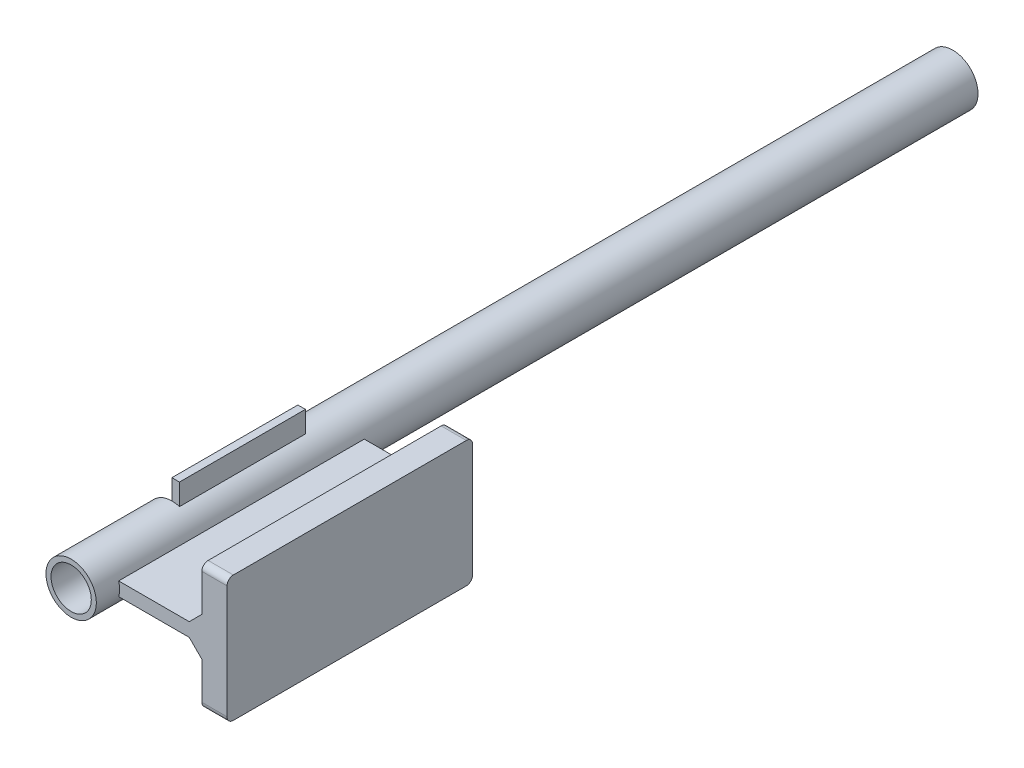
from build123d import *

# Parameters (mm, degrees)
SKETCH1_R           = 20
SKETCH1_R_2         = 16
BOSS_EXTRUDE1_DEPTH = 350
SKETCH2_W           = 46.702536181
SKETCH2_H           = 100
CUT_EXTRUDE1_DEPTH  = 100
SKETCH3_W           = 194.995303171
SKETCH3_H           = 10.817431772
BOSS_EXTRUDE2_DEPTH = 105.29
SKETCH4_W           = 194.995303171
SKETCH4_H           = 100
BOSS_EXTRUDE3_DEPTH = 20
CHAMFER1_SIZE       = 10
FILLET1_R           = 5
SKETCH5_W           = 100
SKETCH5_H           = 20
BOSS_EXTRUDE4_DEPTH = 6


with BuildPart() as part:
    # Sketch1 → Boss-Extrude1 (new, symmetric)
    with BuildSketch(Plane.XY):
        Circle(SKETCH1_R)
        Circle(SKETCH1_R_2, mode=Mode.SUBTRACT)
    extrude(amount=BOSS_EXTRUDE1_DEPTH, both=True)

    # Sketch2 → Cut-Extrude1 (cut, symmetric)
    with BuildSketch(Plane(origin=(0, 0, 0), x_dir=(1, 0, 0), z_dir=(0, 1, 0))):
        with Locations((-23.351268091, -220)):
            Rectangle(SKETCH2_W, SKETCH2_H)
    extrude(amount=CUT_EXTRUDE1_DEPTH, both=True, mode=Mode.SUBTRACT)

    # Sketch3 → Boss-Extrude2 (add)
    with BuildSketch(Plane(origin=(0, 0, 0), x_dir=(0, 0, -1), z_dir=(1, 0, 0))):
        with Locations((-234.028576152, 0)):
            Rectangle(SKETCH3_W, SKETCH3_H)
    extrude(amount=BOSS_EXTRUDE2_DEPTH)

    # Sketch4 → Boss-Extrude3 (add)
    with BuildSketch(Plane(origin=(105.29, 0, 0), x_dir=(0, 0, -1), z_dir=(1, 0, 0))):
        with Locations((-234.028576152, 0)):
            Rectangle(SKETCH4_W, SKETCH4_H)
    extrude(amount=-BOSS_EXTRUDE3_DEPTH)

    # Chamfer1
    chamfer1_edges = [part.edges().sort_by_distance(p)[0] for p in [
        (85.29, -5.408715886, 234.028576151),
        (85.29, 5.408715886, 234.028576151),
    ]]
    chamfer(chamfer1_edges, length=CHAMFER1_SIZE)

    # Fillet1
    fillet1_edges = [part.edges().sort_by_distance(p)[0] for p in [
        (95.29, 50, 136.530924566),
        (95.29, -50, 331.526227737),
        (95.29, -50, 136.530924566),
        (95.29, 50, 331.526227737),
    ]]
    fillet(fillet1_edges, radius=FILLET1_R)

    # Sketch5 → Boss-Extrude4 (add)
    with BuildSketch(Plane.ZY):
        with Locations((220, 26)):
            Rectangle(SKETCH5_W, SKETCH5_H)
        with Locations((220, -26)):
            Rectangle(SKETCH5_W, SKETCH5_H)
    extrude(amount=-BOSS_EXTRUDE4_DEPTH)


solid = part.part
